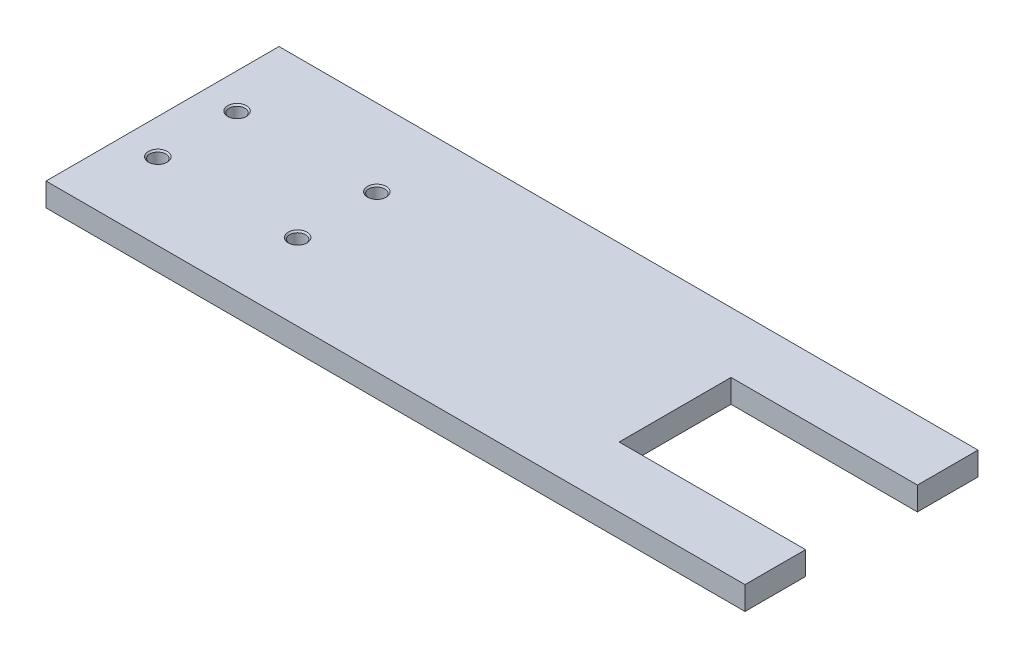
from build123d import *

# Parameters (mm, degrees)
RESSALTO_EXTRUS_O1_DEPTH        = 5
FURO_ROSCADO_DE_M82_D           = 6.8
FURO_ROSCADO_DE_M82_CSINK_D     = 8.05
FURO_ROSCADO_DE_M82_CSINK_ANGLE = 90


with BuildPart() as part:
    # Esboço1 → Ressalto-extrusão1 (new, symmetric)
    with BuildSketch(Plane(origin=(0, 0, 0), x_dir=(1, 0, 0), z_dir=(0, 1, 0))):
        Polygon((70, 24), (150, 24), (150, 50), (-150, 50), (-150, -50), (150, -50), (150, -24), (70, -24), align=None)
    extrude(amount=RESSALTO_EXTRUS_O1_DEPTH, both=True)

    # Furo roscado de M82 (through all)
    with Locations(Plane(origin=(-135, 5, -17), x_dir=(0, 0, 1), z_dir=(0, 1, 0))):
        with Locations((0, 0), (34, 0), (34, 60), (0, 60)):
            CounterSinkHole(FURO_ROSCADO_DE_M82_D / 2, FURO_ROSCADO_DE_M82_CSINK_D / 2, counter_sink_angle=FURO_ROSCADO_DE_M82_CSINK_ANGLE)


solid = part.part
